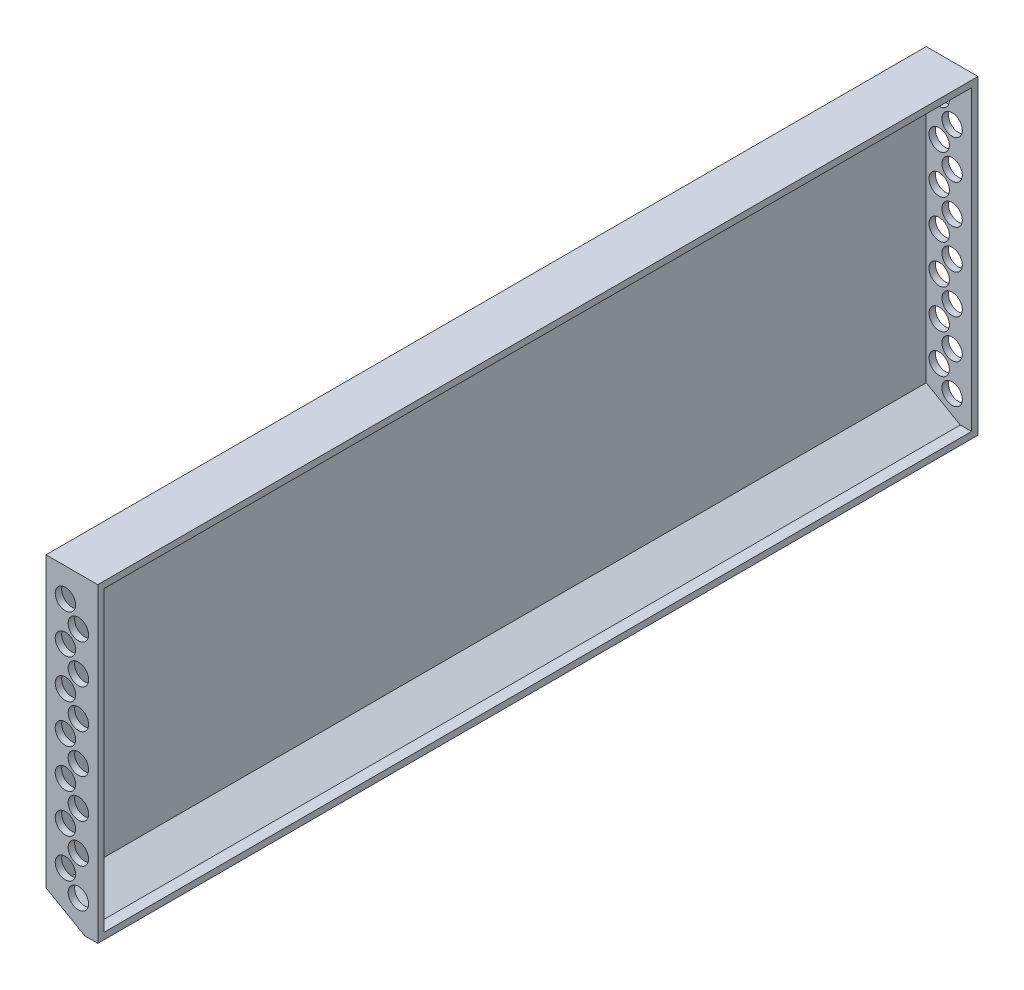
from build123d import *

# Parameters (mm, degrees)
BOSS_EXTRUDE1_DEPTH = 215.9
SHELL1_T            = -3.175
SKETCH2_R           = 5
CUT_EXTRUDE1_DEPTH  = 439.655867395
LPATTERN1_COUNT     = 7
LPATTERN1_PITCH     = 19.05


with BuildPart() as part:
    # Sketch1 → Boss-Extrude1 (new, symmetric)
    with BuildSketch(Plane.XY):
        Polygon((-12.7, -65.28778243), (6.35, -76.2), (12.7, -76.2), (12.7, 76.2), (-12.7, 76.2), align=None)
    extrude(amount=BOSS_EXTRUDE1_DEPTH, both=True)

    # Shell1
    shell1_openings = [part.faces().sort_by_distance(p)[0] for p in [
        (12.7, 0, 0),
    ]]
    offset(amount=SHELL1_T, openings=shell1_openings, kind=Kind.INTERSECTION)

    # Sketch2 → Cut-Extrude1 (cut, through all)
    with BuildSketch(Plane.XY.offset(215.9)):
        with Locations((3.175, -61.681297072)):
            Circle(SKETCH2_R)
        with Locations((-3.175, -52.156297072)):
            Circle(SKETCH2_R)
    cut_extrude1 = extrude(amount=-CUT_EXTRUDE1_DEPTH, mode=Mode.SUBTRACT)

    # LPattern1: Cut-Extrude1 ×7
    with Locations(*[(0, i * LPATTERN1_PITCH, 0) for i in range(1, LPATTERN1_COUNT)]):
        add(cut_extrude1, mode=Mode.SUBTRACT)


solid = part.part
